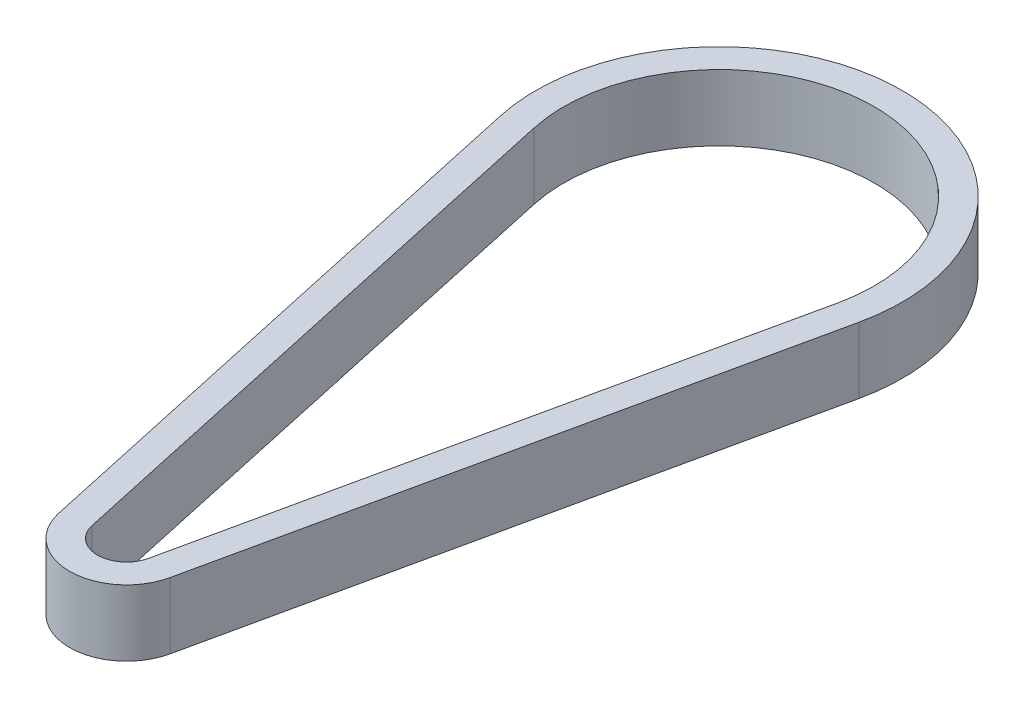
from build123d import *

# Parameters (mm, degrees)
BOSS_EXTRUDE1_DEPTH = 9


with BuildPart() as part:
    # Sketch2 → Boss-Extrude1 (new body)
    with BuildSketch(Plane(origin=(0, 0, 0), x_dir=(1, 0, 0), z_dir=(0, 1, 0))):
        with BuildLine():
            Line((7.5833026, -82.315508267), (24.377229164, -5.316837168))
            ThreePointArc((24.377229164, -5.316837168), (0, 24.950311805), (-24.377229164, -5.316837168))
            Line((-24.377229164, -5.316837168), (-7.5833026, -82.315508267))
            ThreePointArc((-7.5833026, -82.315508267), (0, -88.423117064), (7.5833026, -82.315508267))
        make_face()
        with BuildLine():
            Line((3.860814327, -81.50360861), (20.65474089, -4.504937511))
            ThreePointArc((20.65474089, -4.504937511), (0, 21.140311805), (-20.65474089, -4.504937511))
            Line((-20.65474089, -4.504937511), (-3.860814327, -81.50360861))
            ThreePointArc((-3.860814327, -81.50360861), (0, -84.613117064), (3.860814327, -81.50360861))
        make_face(mode=Mode.SUBTRACT)
    extrude(amount=BOSS_EXTRUDE1_DEPTH)


solid = part.part
